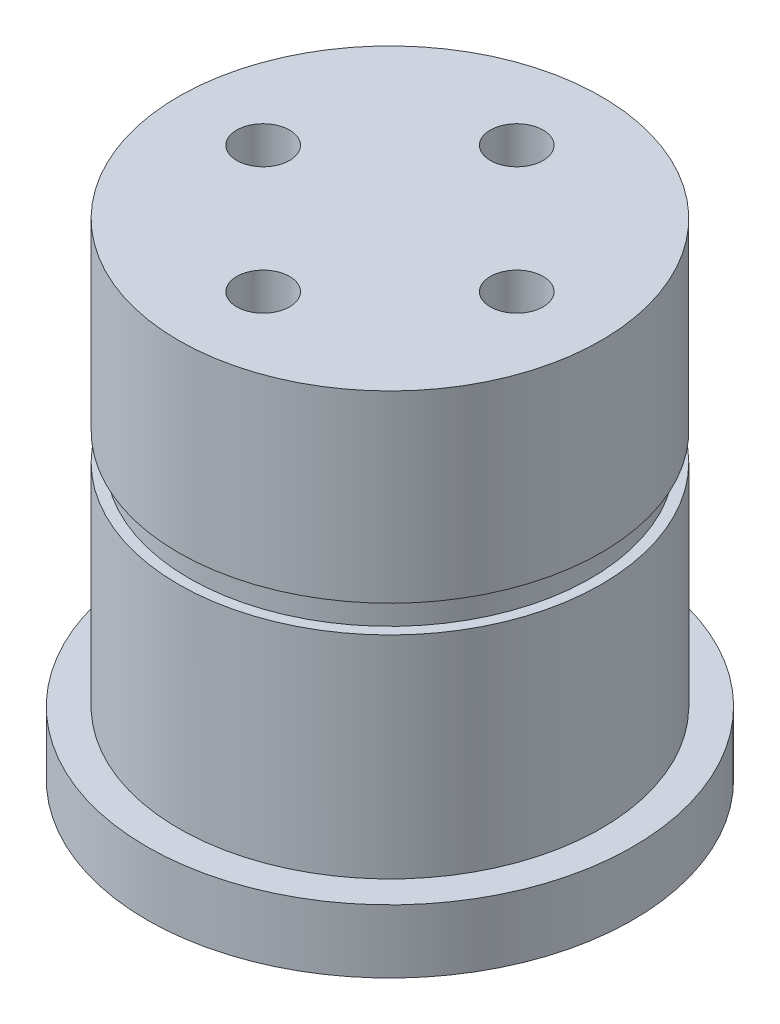
from build123d import *

# Parameters (mm, degrees)
SKETCH_1_R          = 10
EXTRUDE_1_DEPTH     = 23
M3X0_52_D           = 2.5
M3X0_52_DEPTH       = 8.5
M3X0_52_TIP         = 0.751075774
EXTRUDE_START       = 3
SKETCH_10_R         = 11.5
SKETCH_10_R_2       = 10
EXTRUDE_2_DEPTH     = 3
SKETCH_8_R          = 10
SKETCH_8_R_2        = 9.5
CUT_EXTRUDE_1_DEPTH = 1.3


with BuildPart() as part:
    # Эскиз1 → Бобышка-Вытянуть1 (new body)
    with BuildSketch(Plane(origin=(0, 0, 0), x_dir=(1, 0, 0), z_dir=(0, 1, 0))):
        with Locations(Location((0, 0, 0), (0, 0, 270))):
            Circle(SKETCH_1_R)
    extrude(amount=EXTRUDE_1_DEPTH)

    # Отверстие обработанное метчиком M3x0.52
    with Locations(Plane(origin=(-4.838819278, 23, -4.760025704), x_dir=(-1, 0, 0), z_dir=(0, 1, 0))):
        with Locations((-4.838819278, -1.239974296), (-10.838819278, 4.760025704), (-4.838819278, 10.760025704), (1.161180722, 4.760025704)):
            Hole(M3X0_52_D / 2, depth=M3X0_52_DEPTH)
            with Locations((0, 0, -(M3X0_52_DEPTH + M3X0_52_TIP / 2))):  # 118° drill point
                Cone(0, M3X0_52_D / 2, M3X0_52_TIP, mode=Mode.SUBTRACT)

    # Эскиз10 → Бобышка-Вытянуть2 (add)
    with BuildSketch(Plane(origin=(0, 3, 0), x_dir=(-1, 0, 0), z_dir=(0, -1, 0)).offset(EXTRUDE_START)):
        with Locations(Location((0, 0, 0), (0, 0, 270))):
            Circle(SKETCH_10_R)
        with Locations(Location((0, 0, 0), (0, 0, 90))):
            Circle(SKETCH_10_R_2, mode=Mode.SUBTRACT)
    extrude(amount=-EXTRUDE_2_DEPTH)

    # Эскиз8 → Вырез-Вытянуть1 (cut)
    with BuildSketch(Plane(origin=(0, 13, 0), x_dir=(1, 0, 0), z_dir=(0, 1, 0))):
        with Locations(Location((0, 0, 0), (0, 0, 270))):
            Circle(SKETCH_8_R)
        with Locations(Location((0, 0, 0), (0, 0, 270))):
            Circle(SKETCH_8_R_2, mode=Mode.SUBTRACT)
    extrude(amount=CUT_EXTRUDE_1_DEPTH, mode=Mode.SUBTRACT)


solid = part.part
